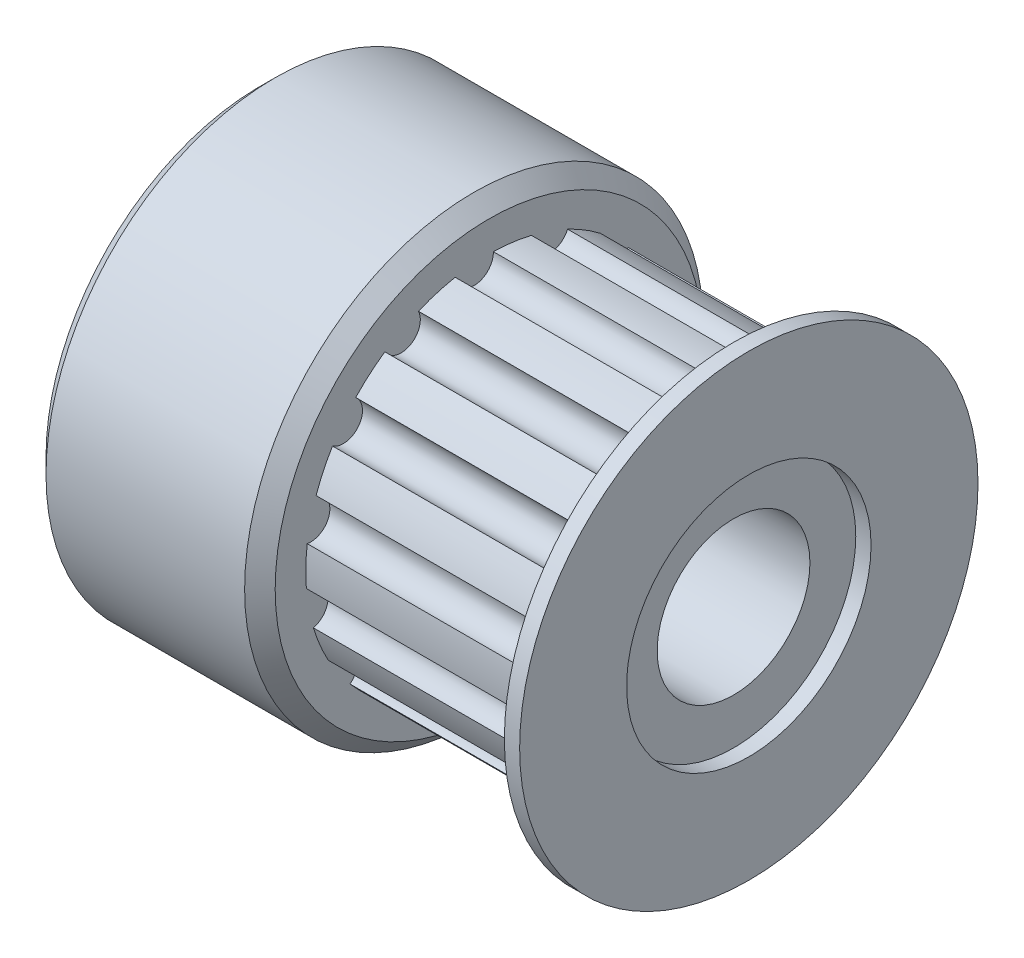
from build123d import *

# Parameters (mm, degrees)
CROQUIS1_W                          = 0.5
CROQUIS1_H                          = 7.5
SALIENTE_EXTRUIR1_DEPTH             = 8
SALIENTE_EXTRUIR2_START             = -7.5
CROQUIS3_R                          = 7.5
SALIENTE_EXTRUIR2_DEPTH             = 7.5
TALADRO_ROSCADO_M8X1_01_D           = 5
TALADRO_ROSCADO_M8X1_01_CBORE_D     = 8
TALADRO_ROSCADO_M8X1_01_CBORE_DEPTH = 0.5
DI_METRO_DE_TALADRO_2_0_2_1_REACH   = 23.031
DI_METRO_DE_TALADRO_2_0_2_1_BORE_R  = 1
DI_METRO_DE_TALADRO_2_0_2_2_REACH   = 154.759
DI_METRO_DE_TALADRO_2_0_2_2_BORE_R  = 1
CHAFL_N1_SIZE                       = 0.5


with BuildPart() as part:
    # Croquis1 → Revolución1 (revolve)
    with BuildSketch(Plane.XY.offset(-121.337715037), mode=Mode.PRIVATE) as revoluci_n1_sk:
        with Locations((80.441710962, -127.720768448)):
            Rectangle(CROQUIS1_W, CROQUIS1_H)
    revolve(revoluci_n1_sk.sketch.rotate(Axis((80.191710962, -131.470768448, -121.337715037), (1, 0, 0)), 270), axis=Axis((80.191710962, -131.470768448, -121.337715037), (1, 0, 0)))

    # Croquis2 → Saliente-Extruir1 (add)
    with BuildSketch(Plane.ZY.offset(-80.191710962)):
        with BuildLine():
            ThreePointArc((-121.477179935, -125.472389538), (-120.901225125, -126.115698851), (-120.228693193, -125.57415327))
            ThreePointArc((-120.228693193, -125.57415327), (-119.617578694, -125.722626925), (-119.02536206, -125.934251157))
            ThreePointArc((-119.02536206, -125.934251157), (-118.760858629, -126.756205384), (-117.926203707, -126.535022259))
            ThreePointArc((-117.926203707, -126.535022259), (-117.428312508, -126.919222352), (-116.973371021, -127.353426914))
            ThreePointArc((-116.973371021, -127.353426914), (-117.066054017, -128.211902701), (-116.213595521, -128.349326603))
            ThreePointArc((-116.213595521, -128.349326603), (-115.915017534, -128.902821448), (-115.676014712, -129.484528426))
            ThreePointArc((-115.676014712, -129.484528426), (-116.109858401, -130.231087511), (-115.386994152, -130.7033566))
            ThreePointArc((-115.386994152, -130.7033566), (-115.339356223, -131.330441909), (-115.357617823, -131.959068883))
            ThreePointArc((-115.357617823, -131.959068883), (-116.057606692, -132.464624418), (-115.589326484, -133.190079077))
            ThreePointArc((-115.589326484, -133.190079077), (-115.800865644, -133.782326104), (-116.073234071, -134.349177758))
            ThreePointArc((-116.073234071, -134.349177758), (-116.918333683, -134.526314599), (-116.785607419, -135.379517127))
            ThreePointArc((-116.785607419, -135.379517127), (-117.219746626, -135.83452098), (-117.699126904, -136.241583514))
            ThreePointArc((-117.699126904, -136.241583514), (-118.577309314, -136.00368104), (-118.768989116, -136.89309702))
            ThreePointArc((-118.768989116, -136.89309702), (-119.350661757, -137.1321834), (-119.954164681, -137.309072004))
            ThreePointArc((-119.954164681, -137.309072004), (-120.659660578, -136.734548313), (-121.196526861, -137.469107043))
            ThreePointArc((-121.196526861, -137.469107043), (-121.825156451, -137.450935742), (-122.448430883, -137.367064769))
            ThreePointArc((-122.448430883, -137.367064769), (-122.878048172, -136.61806557), (-123.648477325, -137.007949829))
            ThreePointArc((-123.648477325, -137.007949829), (-124.215368097, -136.735662831), (-124.750644226, -136.405534334))
            ThreePointArc((-124.750644226, -136.405534334), (-124.795758816, -135.496817323), (-125.700875996, -135.589363651))
            ThreePointArc((-125.700875996, -135.589363651), (-126.108007386, -135.110041851), (-126.462731106, -134.590738047))
            ThreePointArc((-126.462731106, -134.590738047), (-126.134336828, -133.742233992), (-126.998844499, -133.458634946))
            ThreePointArc((-126.998844499, -133.458634946), (-127.175819792, -132.855157438), (-127.288656148, -132.236470672))
            ThreePointArc((-127.288656148, -132.236470672), (-126.709074622, -131.596426869), (-127.317952289, -130.984186065))
            ThreePointArc((-127.317952289, -130.984186065), (-127.234170847, -130.360899591), (-127.08560941, -129.749806426))
            ThreePointArc((-127.08560941, -129.749806426), (-126.295806072, -129.400834361), (-126.603022729, -128.593871697))
            ThreePointArc((-126.603022729, -128.593871697), (-126.272971126, -128.058548153), (-125.888699517, -127.560712148))
            ThreePointArc((-125.888699517, -127.560712148), (-125.025238539, -127.563152262), (-124.977673635, -126.700998914))
            ThreePointArc((-124.977673635, -126.700998914), (-124.458420791, -126.346200603), (-123.904883063, -126.047702126))
            ThreePointArc((-123.904883063, -126.047702126), (-123.117064692, -126.4011325), (-122.722942632, -125.632862615))
            ThreePointArc((-122.722942632, -125.632862615), (-122.104272081, -125.519937388), (-121.477179935, -125.472389538))
        make_face()
    extrude(amount=SALIENTE_EXTRUIR1_DEPTH)

    # Croquis3 → Saliente-Extruir2 (add)
    with BuildSketch(Plane(origin=(72.191710962, 0, 0), x_dir=(0, 0, -1), z_dir=(1, 0, 0)).offset(SALIENTE_EXTRUIR2_START)):
        with Locations((121.337715037, -131.470768448)):
            Circle(CROQUIS3_R)
    extrude(amount=SALIENTE_EXTRUIR2_DEPTH)

    # Taladro roscado M8x1.01 (through all)
    with Locations(Plane(origin=(80.691710962, 0, 0), x_dir=(0, 0, -1), z_dir=(1, 0, 0))):
        with Locations((121.337715037, -131.470768448)):
            CounterBoreHole(TALADRO_ROSCADO_M8X1_01_D / 2, TALADRO_ROSCADO_M8X1_01_CBORE_D / 2, TALADRO_ROSCADO_M8X1_01_CBORE_DEPTH)

    # Diámetro de taladro Ø2.0 (2)1 bore (on position points) → Diámetro de taladro Ø2.0 (2)1 (cut, up to next)
    with BuildSketch(Plane(origin=(69.727332034, -135.169093948, -127.862467024), x_dir=(0, -0.869966931618, 0.49311006671), z_dir=(0, -0.49311006671, -0.869966931618)), mode=Mode.PRIVATE) as di_metro_de_taladro_2_0_2_1_sk1:
        Circle(DI_METRO_DE_TALADRO_2_0_2_1_BORE_R)
    di_metro_de_taladro_2_0_2_1_tool1 = extrude(di_metro_de_taladro_2_0_2_1_sk1.sketch, amount=-DI_METRO_DE_TALADRO_2_0_2_1_REACH, mode=Mode.PRIVATE) & part.part
    add(di_metro_de_taladro_2_0_2_1_tool1.solids().sort_by_distance((69.727332, -135.169094, -127.862467))[0], mode=Mode.SUBTRACT)

    # Diámetro de taladro Ø2.0 (2)2 bore → Diámetro de taladro Ø2.0 (2)2 (cut, up to next)
    with BuildSketch(Plane(origin=(0, -138.970768448, 0), x_dir=(-1, 0, 0), z_dir=(0, -1, 0)), mode=Mode.PRIVATE) as di_metro_de_taladro_2_0_2_2_sk1:
        with Locations((-69.727332034, 121.397247196)):
            Circle(DI_METRO_DE_TALADRO_2_0_2_2_BORE_R)
    di_metro_de_taladro_2_0_2_2_tool1 = extrude(di_metro_de_taladro_2_0_2_2_sk1.sketch, amount=-DI_METRO_DE_TALADRO_2_0_2_2_REACH, mode=Mode.PRIVATE) & part.part
    add(di_metro_de_taladro_2_0_2_2_tool1.solids().sort_by_distance((69.727332, -138.970768, -121.397247))[0], mode=Mode.SUBTRACT)

    # Chaflán1
    chafl_n1_edges = [part.edges().sort_by_distance(p)[0] for p in [
        (72.191710962, -131.470768448, -113.837715037),
        (64.691710962, -131.470768448, -113.837715037),
    ]]
    chamfer(chafl_n1_edges, length=CHAFL_N1_SIZE)


solid = part.part
